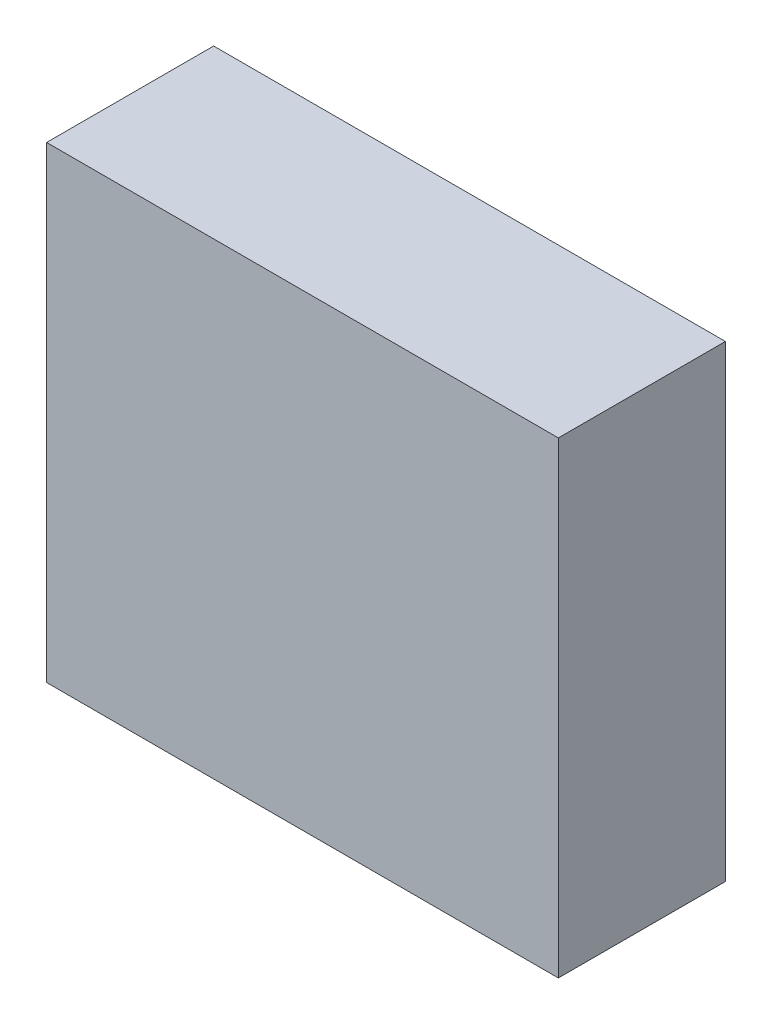
from build123d import *

# Parameters (mm, degrees)
SKETCH1_W               = 3.0635
SKETCH1_H               = 2.8
COMPONENT_OUTLINE_DEPTH = 1


with BuildPart() as part:
    # Sketch1 → Component_Outline (new body)
    with BuildSketch(Plane.XY):
        with Locations((-0.06825, 0)):
            Rectangle(SKETCH1_W, SKETCH1_H)
    extrude(amount=COMPONENT_OUTLINE_DEPTH)


solid = part.part
